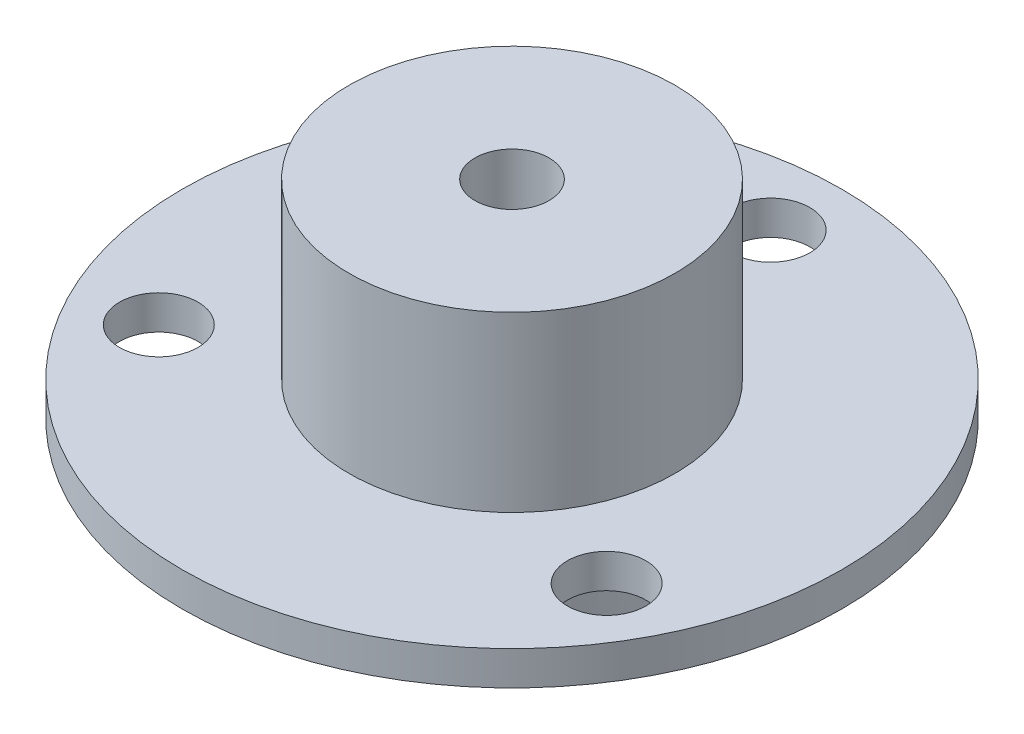
from build123d import *

# Parameters (mm, degrees)
SKETCH2_R          = 2.65
CUT_EXTRUDE1_DEPTH = 34.571044071


with BuildPart() as part:
    # Sketch1 → Revolve1 (revolve)
    with BuildSketch(Plane.XY, mode=Mode.PRIVATE) as revolve1_sk:
        Polygon((-2.5, 0), (-2.5, 19), (-11, 19), (-11, 7.3), (-22.25, 7.3), (-22.25, 5), (-11, 5), (-11, 0), align=None)
    revolve(revolve1_sk.sketch.rotate(Axis((0, 0, 0), (0, 1, 0)), 270), axis=Axis((0, 0, 0), (0, 1, 0)))

    # Sketch2 → Cut-Extrude1 (cut, through all)
    with BuildSketch(Plane(origin=(0, 7.3, 0), x_dir=(1, 0, 0), z_dir=(0, 1, 0))):
        with Locations(Location((0, 17.45, 0), (0, 0, 270))):
            Circle(SKETCH2_R)
        with Locations(Location((15.112143296, -8.725, 0), (0, 0, 270))):
            Circle(SKETCH2_R)
        with Locations(Location((-15.112143296, -8.725, 0), (0, 0, 270))):
            Circle(SKETCH2_R)
    extrude(amount=-CUT_EXTRUDE1_DEPTH, mode=Mode.SUBTRACT)


solid = part.part
